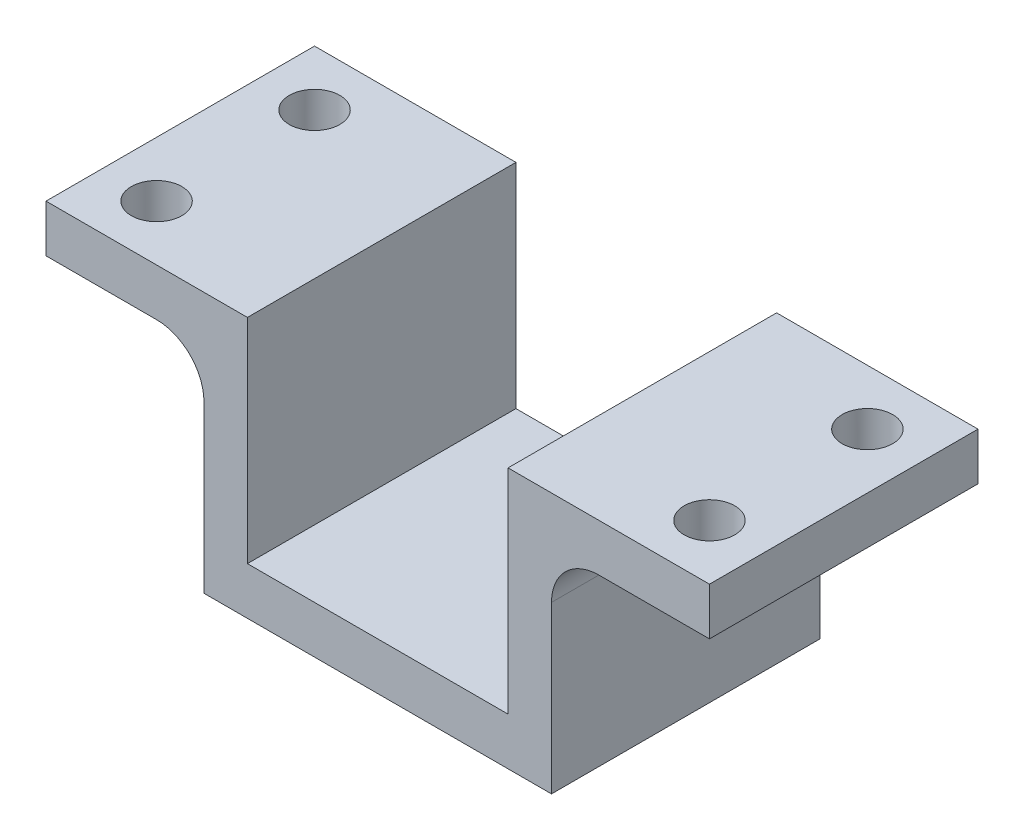
from build123d import *

# Parameters (mm, degrees)
SKETCH_1_W          = 22
SKETCH_1_H          = 17
EXTRUDE_1_DEPTH     = 3
SKETCH_2_W          = 2.75
SKETCH_2_H          = 17
EXTRUDE_2_DEPTH     = 13.5
SKETCH_3_W          = 10
SKETCH_3_H          = 17
EXTRUDE_3_DEPTH     = 3
CUT_EXTRUDE_1_REACH = 30.027
SKETCH_4_R          = 1.6
FILLET_1_R          = 3


with BuildPart() as part:
    # 草图1 → 凸台-拉伸1 (new body)
    with BuildSketch(Plane(origin=(0, 0, 0), x_dir=(1, 0, 0), z_dir=(0, 1, 0))):
        Rectangle(SKETCH_1_W, SKETCH_1_H)
    extrude(amount=EXTRUDE_1_DEPTH)

    # 草图2 → 凸台-拉伸2 (add)
    with BuildSketch(Plane(origin=(0, 3, 0), x_dir=(1, 0, 0), z_dir=(0, 1, 0))):
        with Locations((-9.625, 0)):
            Rectangle(SKETCH_2_W, SKETCH_2_H)
        with Locations((9.625, 0)):
            Rectangle(SKETCH_2_W, SKETCH_2_H)
    extrude(amount=EXTRUDE_2_DEPTH)

    # 草图3 → 凸台-拉伸3 (add)
    with BuildSketch(Plane(origin=(0, 16.5, 0), x_dir=(1, 0, 0), z_dir=(0, 1, 0))):
        with Locations((16, 0)):
            Rectangle(SKETCH_3_W, SKETCH_3_H)
        with Locations((-16, 0)):
            Rectangle(SKETCH_3_W, SKETCH_3_H)
    extrude(amount=-EXTRUDE_3_DEPTH)

    # 草图4 → 切除-拉伸1 (cut, up to next)
    with BuildSketch(Plane(origin=(0, 16.5, 0), x_dir=(1, 0, 0), z_dir=(0, 1, 0)), mode=Mode.PRIVATE) as cut_extrude_1_sk1:
        with Locations(Location((-17.5, 5, 0), (0, 0, 270))):
            Circle(SKETCH_4_R)
    cut_extrude_1_tool1 = extrude(cut_extrude_1_sk1.sketch, amount=-CUT_EXTRUDE_1_REACH, mode=Mode.PRIVATE) & part.part
    # 草图4 → 切除-拉伸1 (cut, up to next)
    with BuildSketch(Plane(origin=(0, 16.5, 0), x_dir=(1, 0, 0), z_dir=(0, 1, 0)), mode=Mode.PRIVATE) as cut_extrude_1_sk2:
        with Locations(Location((-17.5, -5, 0), (0, 0, 90))):
            Circle(SKETCH_4_R)
    cut_extrude_1_tool2 = extrude(cut_extrude_1_sk2.sketch, amount=-CUT_EXTRUDE_1_REACH, mode=Mode.PRIVATE) & part.part
    # 草图4 → 切除-拉伸1 (cut, up to next)
    with BuildSketch(Plane(origin=(0, 16.5, 0), x_dir=(1, 0, 0), z_dir=(0, 1, 0)), mode=Mode.PRIVATE) as cut_extrude_1_sk3:
        with Locations(Location((17.5, -5, 0), (0, 0, 270))):
            Circle(SKETCH_4_R)
    cut_extrude_1_tool3 = extrude(cut_extrude_1_sk3.sketch, amount=-CUT_EXTRUDE_1_REACH, mode=Mode.PRIVATE) & part.part
    # 草图4 → 切除-拉伸1 (cut, up to next)
    with BuildSketch(Plane(origin=(0, 16.5, 0), x_dir=(1, 0, 0), z_dir=(0, 1, 0)), mode=Mode.PRIVATE) as cut_extrude_1_sk4:
        with Locations(Location((17.5, 5, 0), (0, 0, 270))):
            Circle(SKETCH_4_R)
    cut_extrude_1_tool4 = extrude(cut_extrude_1_sk4.sketch, amount=-CUT_EXTRUDE_1_REACH, mode=Mode.PRIVATE) & part.part
    add(cut_extrude_1_tool1.solids().sort_by_distance((-17.5, 16.5, -5))[0], mode=Mode.SUBTRACT)
    add(cut_extrude_1_tool2.solids().sort_by_distance((-17.5, 16.5, 5))[0], mode=Mode.SUBTRACT)
    add(cut_extrude_1_tool3.solids().sort_by_distance((17.5, 16.5, 5))[0], mode=Mode.SUBTRACT)
    add(cut_extrude_1_tool4.solids().sort_by_distance((17.5, 16.5, -5))[0], mode=Mode.SUBTRACT)

    # 圆角1
    fillet_1_edges = [part.edges().sort_by_distance(p)[0] for p in [
        (11, 13.5, 0),
        (-11, 13.5, 0),
    ]]
    fillet(fillet_1_edges, radius=FILLET_1_R)


solid = part.part
